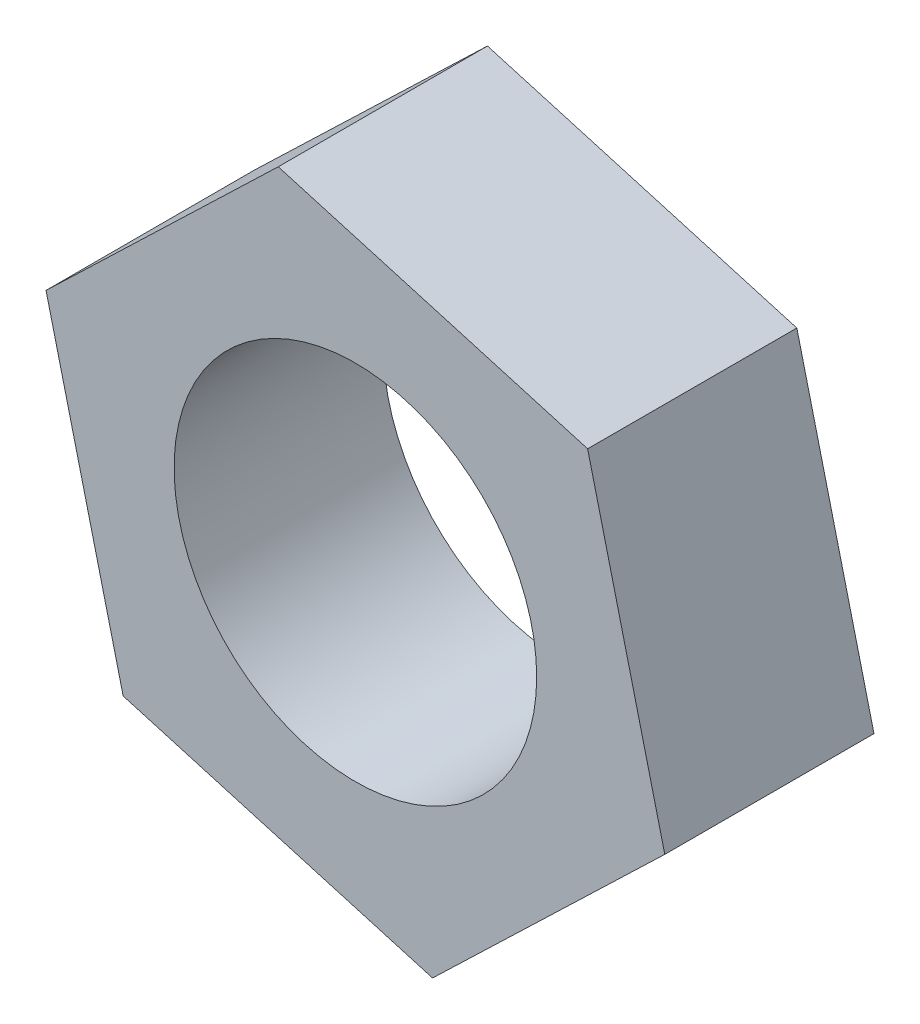
from build123d import *

# Parameters (mm, degrees)
CROQUIS1_R              = 2.6
SALIENTE_EXTRUIR1_DEPTH = 3


with BuildPart() as part:
    # Croquis1 → Saliente-Extruir1 (new body)
    with BuildSketch(Plane.XY):
        Polygon((1.106260402, -4.484364086), (4.436703419, -1.284132431), (3.330443017, 3.200231655), (-1.106260402, 4.484364086), (-4.436703419, 1.284132431), (-3.330443017, -3.200231655), align=None)
        Circle(CROQUIS1_R, mode=Mode.SUBTRACT)
    extrude(amount=SALIENTE_EXTRUIR1_DEPTH)


solid = part.part
